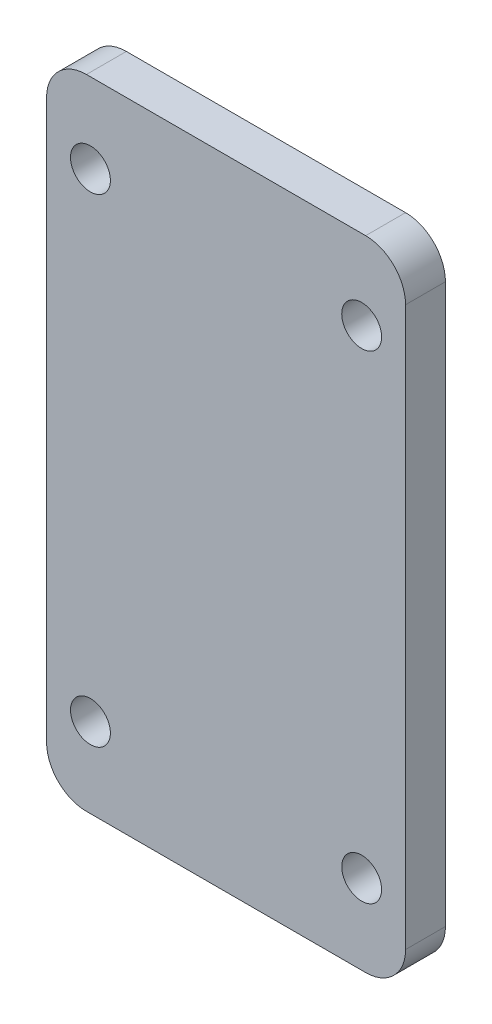
from build123d import *

# Parameters (mm, degrees)
ESQUISSE1_W        = 45
ESQUISSE1_H        = 80
ESQUISSE1_R        = 2.5
BOSS_EXTRU_1_DEPTH = 5
CONG_1_R           = 5


with BuildPart() as part:
    # Esquisse1 → Boss.-Extru.1 (new body)
    with BuildSketch(Plane.XY):
        Rectangle(ESQUISSE1_W, ESQUISSE1_H)
        with Locations((-17, 30)):
            Circle(ESQUISSE1_R, mode=Mode.SUBTRACT)
        with Locations(Location((-17, -30, 0), (0, 0, 180))):
            Circle(ESQUISSE1_R, mode=Mode.SUBTRACT)
        with Locations((17, -30)):
            Circle(ESQUISSE1_R, mode=Mode.SUBTRACT)
        with Locations(Location((17, 30, 0), (0, 0, 180))):
            Circle(ESQUISSE1_R, mode=Mode.SUBTRACT)
    extrude(amount=BOSS_EXTRU_1_DEPTH)

    # Congé1
    cong_1_edges = [part.edges().sort_by_distance(p)[0] for p in [
        (22.5, -40, 2.5),
        (-22.5, -40, 2.5),
        (-22.5, 40, 2.5),
        (22.5, 40, 2.5),
    ]]
    fillet(cong_1_edges, radius=CONG_1_R)


solid = part.part
